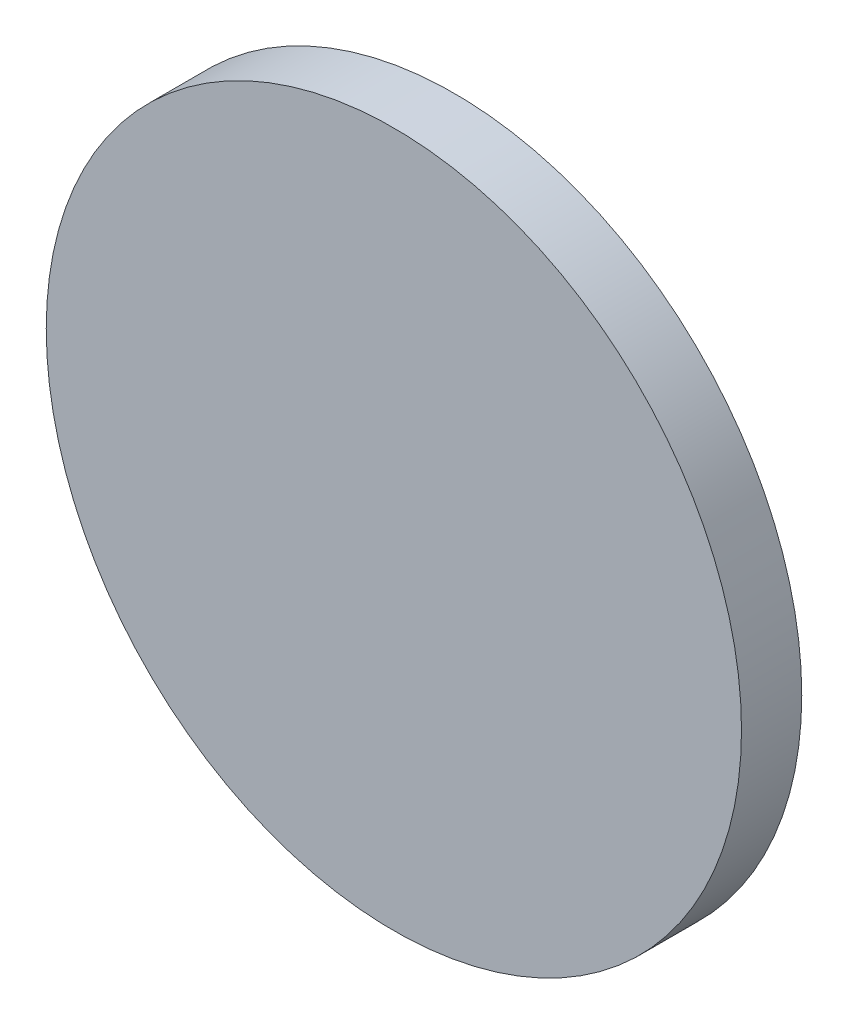
from build123d import *

# Parameters (mm, degrees)
SKETCH1_R           = 37.5
BOSS_EXTRUDE1_DEPTH = 6.5


with BuildPart() as part:
    # Sketch1 → Boss-Extrude1 (new body)
    with BuildSketch(Plane.XY):
        with Locations(Location((0, 0, 0), (0, 0, 180))):
            Circle(SKETCH1_R)
    extrude(amount=BOSS_EXTRUDE1_DEPTH)


solid = part.part
